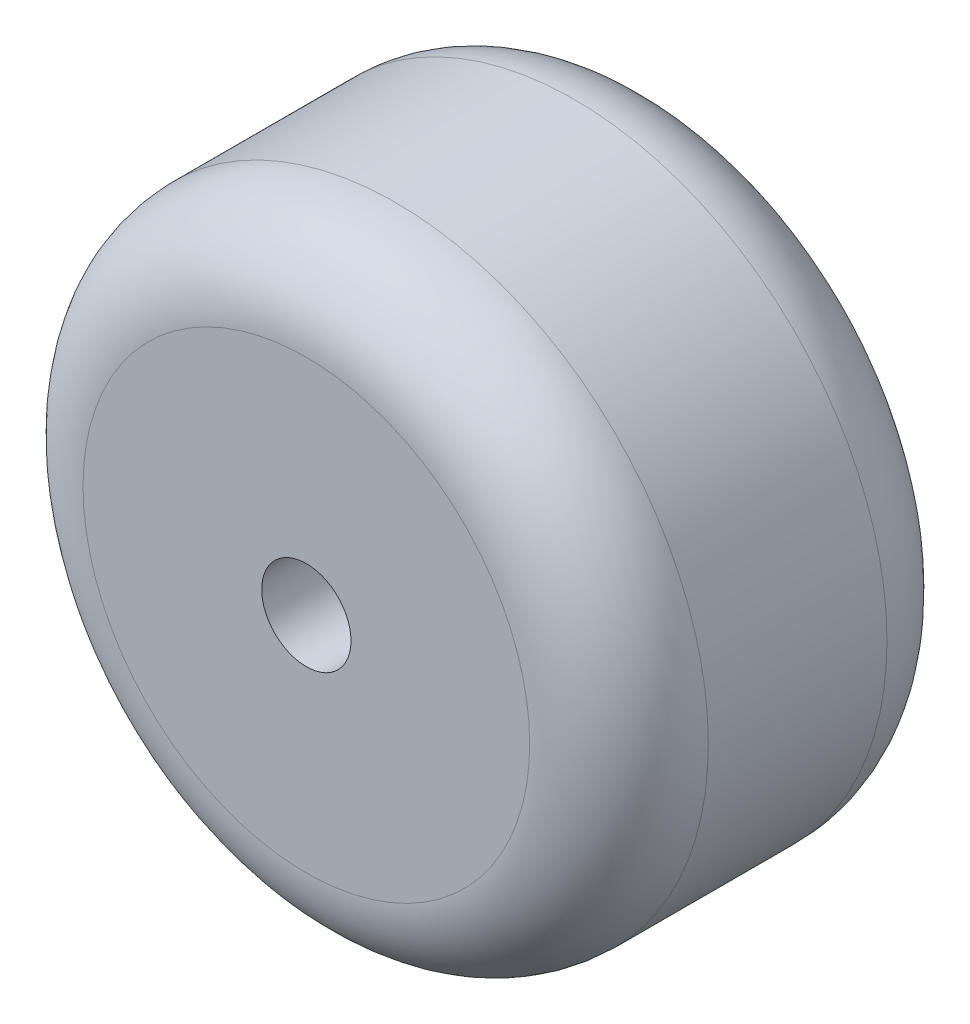
from build123d import *

# Parameters (mm, degrees)
SKETCH1_R           = 35
BOSS_EXTRUDE1_DEPTH = 40
FILLET1_R           = 10
SKETCH2_R           = 5
CUT_EXTRUDE1_DEPTH  = 40


with BuildPart() as part:
    # Sketch1 → Boss-Extrude1 (new body)
    with BuildSketch(Plane.XY):
        Circle(SKETCH1_R)
    extrude(amount=BOSS_EXTRUDE1_DEPTH)

    # Fillet1
    fillet1_edges = [part.edges().sort_by_distance(p)[0] for p in [
        (-35, 0, 0),
        (-35, 0, 40),
    ]]
    fillet(fillet1_edges, radius=FILLET1_R)

    # Sketch2 → Cut-Extrude1 (cut)
    with BuildSketch(Plane.XY.offset(40)):
        Circle(SKETCH2_R)
    extrude(amount=-CUT_EXTRUDE1_DEPTH, mode=Mode.SUBTRACT)


solid = part.part
